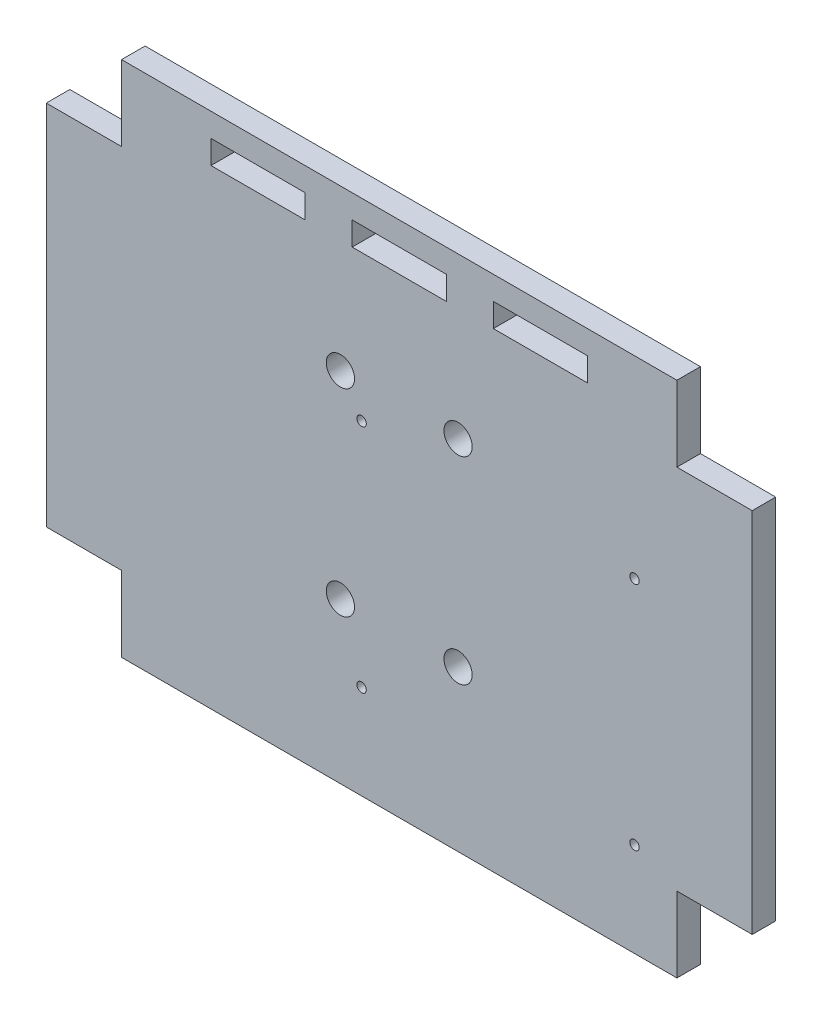
from build123d import *

# Parameters (mm, degrees)
BOSS_EXTRU_1_DEPTH      = 5
ESQUISSE2_R             = 1
ENL_V_MAT_EXTRU_1_DEPTH = 115.236596588
ESQUISSE3_R             = 3
ENL_V_MAT_EXTRU_2_DEPTH = 115.236596588
ESQUISSE4_W             = 20
ESQUISSE4_H             = 5
ENL_V_MAT_EXTRU_3_DEPTH = 115.236596588


with BuildPart() as part:
    # Esquisse1 → Boss.-Extru.1 (new body)
    with BuildSketch(Plane.XY):
        Polygon((-34, 55), (84, 55), (84, 39), (100, 39), (100, -39), (84, -39), (84, -55), (-34, -55), (-34, -39), (-50, -39), (-50, 39), (-34, 39), align=None)
    extrude(amount=-BOSS_EXTRU_1_DEPTH)

    # Esquisse2 → Enlèv. mat.-Extru.1 (cut, through all)
    with BuildSketch(Plane(origin=(0, 0, -5), x_dir=(-1, 0, 0), z_dir=(0, 0, -1))):
        with Locations((-75, -35)):
            Circle(ESQUISSE2_R)
        with Locations((-17, -35)):
            Circle(ESQUISSE2_R)
        with Locations((-75, 14)):
            Circle(ESQUISSE2_R)
        with Locations((-17, 14)):
            Circle(ESQUISSE2_R)
    extrude(amount=-ENL_V_MAT_EXTRU_1_DEPTH, mode=Mode.SUBTRACT)

    # Esquisse3 → Enlèv. mat.-Extru.2 (cut, through all)
    with BuildSketch(Plane(origin=(0, 0, -5), x_dir=(-1, 0, 0), z_dir=(0, 0, -1))):
        with Locations((-37.5, -21)):
            Circle(ESQUISSE3_R)
        with Locations((-37.5, 21)):
            Circle(ESQUISSE3_R)
        with Locations((-12.5, 21)):
            Circle(ESQUISSE3_R)
        with Locations((-12.5, -21)):
            Circle(ESQUISSE3_R)
    extrude(amount=-ENL_V_MAT_EXTRU_2_DEPTH, mode=Mode.SUBTRACT)

    # Esquisse4 → Enlèv. mat.-Extru.3 (cut, through all)
    with BuildSketch(Plane(origin=(0, 0, -5), x_dir=(-1, 0, 0), z_dir=(0, 0, -1))):
        with Locations((-55, 47.5)):
            Rectangle(ESQUISSE4_W, ESQUISSE4_H)
        with Locations((-25, 47.5)):
            Rectangle(ESQUISSE4_W, ESQUISSE4_H)
        with Locations((5, 47.5)):
            Rectangle(ESQUISSE4_W, ESQUISSE4_H)
    extrude(amount=-ENL_V_MAT_EXTRU_3_DEPTH, mode=Mode.SUBTRACT)


solid = part.part
